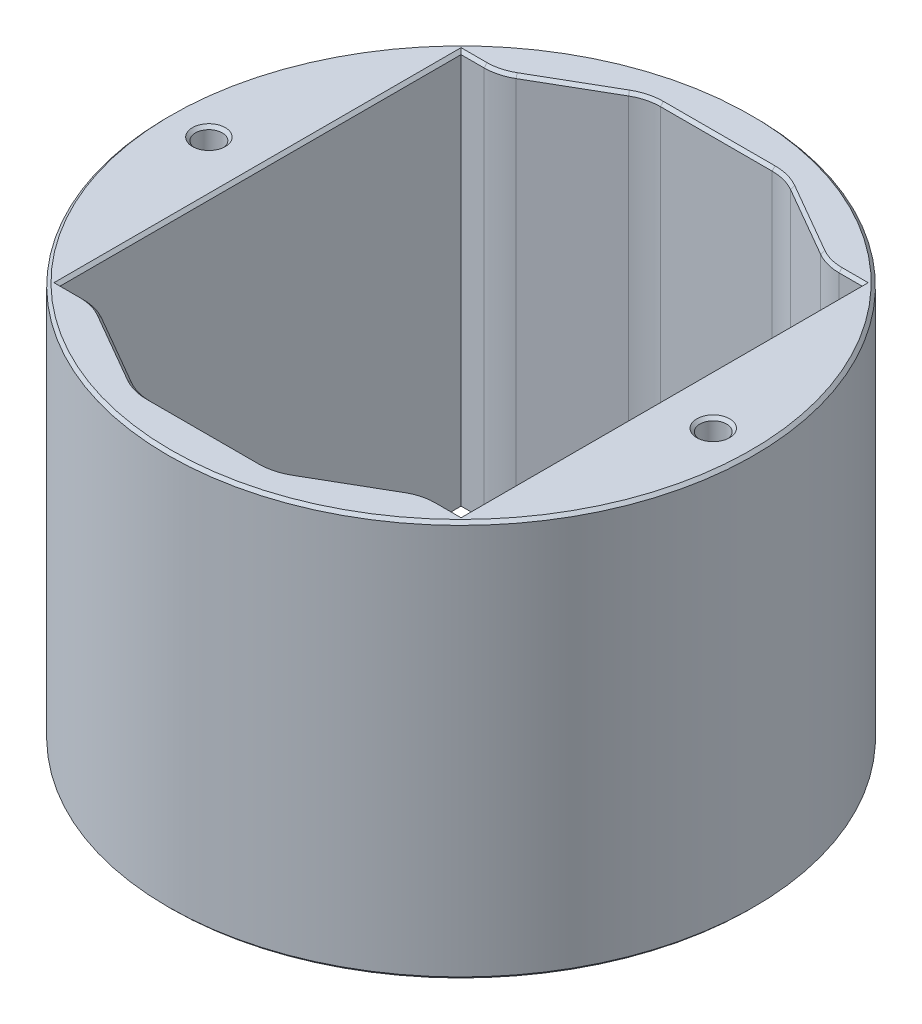
from build123d import *

# Parameters (mm, degrees)
HOLDER_SECTION_PROFILE_R    = 73.787
HOLDER_SECTION_BODY_DEPTH   = 100
PAYLOAD_HOLE_PROFILE_W      = 101
PAYLOAD_HOLE_PROFILE_H      = 101
PAYLOAD_HOLE_CUT_DEPTH      = 145.530421497
ACCESS_HOLE_CUT_DEPTH       = 145.530421497
FILLET1_R                   = 12.7
THREADED_ROD_HOLE_PROFILE_R = 3.3782
THREADED_ROD_HOLE_CUT_DEPTH = 145.530421497
CHAMFER1_SIZE               = 0.762


with BuildPart() as part:
    # Holder Section Profile → Holder Section Body (new body)
    with BuildSketch(Plane(origin=(0, 0, 0), x_dir=(1, 0, 0), z_dir=(0, 1, 0))):
        with Locations(Location((0, 0, 0), (0, 0, 270))):
            Circle(HOLDER_SECTION_PROFILE_R)
    extrude(amount=HOLDER_SECTION_BODY_DEPTH)

    # Payload Hole Profile → Payload Hole Cut (cut, through all)
    with BuildSketch(Plane(origin=(0, 100, 0), x_dir=(1, 0, 0), z_dir=(0, 1, 0))):
        Rectangle(PAYLOAD_HOLE_PROFILE_W, PAYLOAD_HOLE_PROFILE_H)
    extrude(amount=-PAYLOAD_HOLE_CUT_DEPTH, mode=Mode.SUBTRACT)

    # Access Hole Profile → Access Hole Cut (cut, through all)
    with BuildSketch(Plane(origin=(0, 100, 0), x_dir=(1, 0, 0), z_dir=(0, 1, 0))):
        Polygon((-17.4625, -64.2619994), (17.4625, -64.2619994), (41.298982175, -50.5), (-41.298982175, -50.5), align=None)
    access_hole_cut = extrude(amount=-ACCESS_HOLE_CUT_DEPTH, mode=Mode.SUBTRACT)

    # Access Hole Mirror: Access Hole Cut across plane
    add(access_hole_cut.mirror(Plane(origin=(0, 0, 0), x_dir=(1, 0, 0), z_dir=(0, 0, -1))), mode=Mode.SUBTRACT)

    # Fillet1
    fillet1_edges = [part.edges().sort_by_distance(p)[0] for p in [
        (-17.4625, 50, 64.2619994),
        (-41.298982175, 50, 50.5),
        (41.298982175, 50, 50.5),
        (17.4625, 50, 64.2619994),
        (-41.298982175, 50, -50.5),
        (-17.4625, 50, -64.2619994),
        (17.4625, 50, -64.2619994),
        (41.298982175, 50, -50.5),
    ]]
    fillet(fillet1_edges, radius=FILLET1_R)

    # Threaded Rod Hole Profile → Threaded Rod Hole Cut (cut, through all)
    with BuildSketch(Plane(origin=(0, 100, 0), x_dir=(1, 0, 0), z_dir=(0, 1, 0))):
        with Locations(Location((-63.5, 0, 0), (0, 0, 270))):
            Circle(THREADED_ROD_HOLE_PROFILE_R)
        with Locations(Location((63.5, 0, 0), (0, 0, 270))):
            Circle(THREADED_ROD_HOLE_PROFILE_R)
    extrude(amount=-THREADED_ROD_HOLE_CUT_DEPTH, mode=Mode.SUBTRACT)

    # Chamfer1
    chamfer1_edges = [part.edges().sort_by_distance(p)[0] for p in [
        (50.5, 0, 0),
        (-47.600968459, 0, 50.5),
        (-50.5, 0, 0),
        (47.600968459, 0, -50.5),
        (50.5, 100, 0),
        (-63.5, 0, -3.3782),
        (-63.5, 100, -3.3782),
        (63.5, 0, -3.3782),
        (47.600968459, 100, -50.5),
        (63.5, 100, -3.3782),
        (-50.5, 100, 0),
        (-47.600968459, 100, 50.5),
        (0, 0, -73.787),
        (0, 100, -73.787),
        (29.380741087, 100, 57.3809997),
        (29.380741087, 0, 57.3809997),
        (0, 100, 64.2619994),
        (0, 0, 64.2619994),
        (47.600968459, 0, 50.5),
        (47.600968459, 100, 50.5),
        (-47.600968459, 100, -50.5),
        (-29.380741087, 100, -57.3809997),
        (0, 100, -64.2619994),
        (29.380741087, 100, -57.3809997),
        (-29.380741087, 100, 57.3809997),
        (-41.414935046, 100, -50.932742006),
        (41.414935046, 100, -50.932742006),
        (-41.414935046, 100, 50.932742006),
        (41.414935046, 100, 50.932742006),
        (-29.380741087, 0, -57.3809997),
        (-47.600968459, 0, -50.5),
        (-29.380741087, 0, 57.3809997),
        (29.380741087, 0, -57.3809997),
        (0, 0, -64.2619994),
        (-41.414935046, 0, -50.932742006),
        (41.414935046, 0, -50.932742006),
        (-41.414935046, 0, 50.932742006),
        (41.414935046, 0, 50.932742006),
        (17.346547129, 100, 63.829257394),
        (17.346547129, 0, 63.829257394),
        (-17.346547129, 100, 63.829257394),
        (-17.346547129, 0, 63.829257394),
        (17.346547129, 100, -63.829257394),
        (17.346547129, 0, -63.829257394),
        (-17.346547129, 100, -63.829257394),
        (-17.346547129, 0, -63.829257394),
    ]]
    chamfer(chamfer1_edges, length=CHAMFER1_SIZE)


solid = part.part
